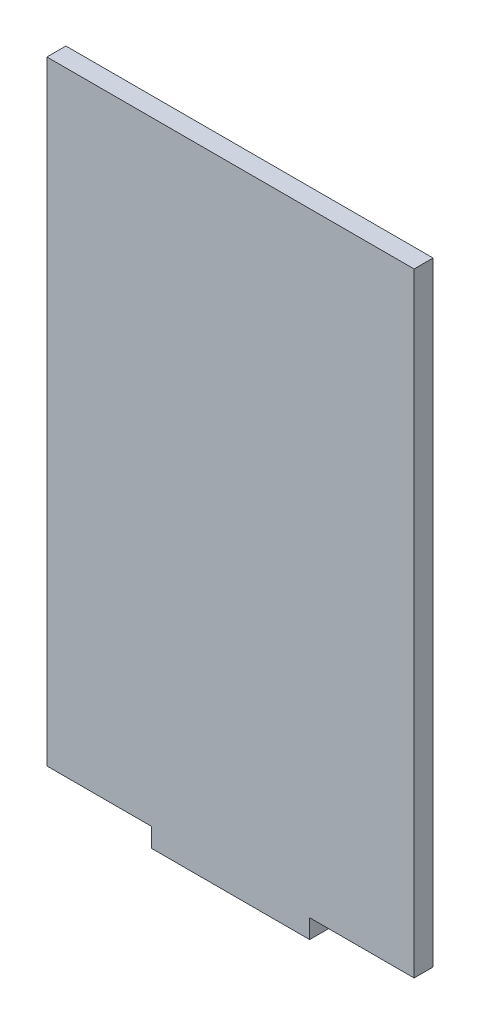
from build123d import *

# Parameters (mm, degrees)
BOSS_EXTRUDE1_DEPTH = 6


with BuildPart() as part:
    # Sketch1 → Boss-Extrude1 (new body)
    with BuildSketch(Plane.XY):
        Polygon((-41, 219), (-41, 25), (-8, 25), (-8, 19), (42, 19), (42, 25), (75, 25), (75, 219), align=None)
    extrude(amount=BOSS_EXTRUDE1_DEPTH)


solid = part.part
